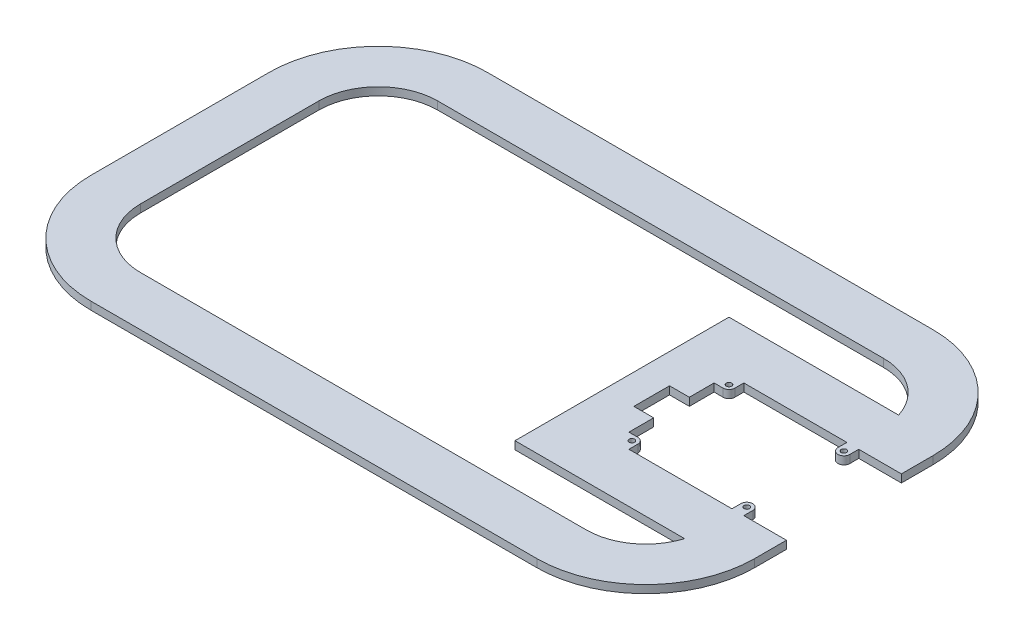
from build123d import *

# Parameters (mm, degrees)
SKETCH1_R           = 1.375
BOSS_EXTRUDE1_DEPTH = 4


with BuildPart() as part:
    # Sketch1 → Boss-Extrude1 (new body)
    with BuildSketch(Plane(origin=(0, 0, 0), x_dir=(1, 0, 0), z_dir=(0, 1, 0))):
        with BuildLine():
            Line((55, 0), (280, 0))
            ThreePointArc((280, 0), (318.890872965, 16.109127035), (335, 55))
            Line((335, 55), (335, 71))
            Line((335, 71), (313.5, 71))
            Line((313.5, 71), (313.5, 75.5))
            ThreePointArc((313.5, 75.5), (310.5, 78.5), (307.5, 75.5))
            Line((307.5, 75.5), (307.5, 71))
            Line((307.5, 71), (255.5, 71))
            Line((255.5, 71), (255.5, 75.5))
            ThreePointArc((255.5, 75.5), (254.621320344, 77.621320344), (252.5, 78.5))
            Line((252.5, 78.5), (248, 78.5))
            Line((248, 78.5), (248, 91))
            Line((248, 91), (238, 91))
            Line((238, 91), (238, 109))
            Line((238, 109), (248, 109))
            Line((248, 109), (248, 121.5))
            Line((248, 121.5), (252.5, 121.5))
            ThreePointArc((252.5, 121.5), (254.621320344, 122.378679656), (255.5, 124.5))
            Line((255.5, 124.5), (255.5, 129))
            Line((255.5, 129), (307.5, 129))
            Line((307.5, 129), (307.5, 124.5))
            ThreePointArc((307.5, 124.5), (310.5, 121.5), (313.5, 124.5))
            Line((313.5, 124.5), (313.5, 129))
            Line((313.5, 129), (335, 129))
            Line((335, 129), (335, 145))
            ThreePointArc((335, 145), (318.890872965, 183.890872965), (280, 200))
            Line((280, 200), (55, 200))
            ThreePointArc((55, 200), (16.109127035, 183.890872965), (0, 145))
            Line((0, 145), (0, 55))
            ThreePointArc((0, 55), (16.109127035, 16.109127035), (55, 0))
        make_face()
        with Locations(Location((252.5, 124.5, 0), (0, 0, 270))):
            Circle(SKETCH1_R, mode=Mode.SUBTRACT)
        with Locations(Location((252.5, 75.5, 0), (0, 0, 90))):
            Circle(SKETCH1_R, mode=Mode.SUBTRACT)
        with Locations(Location((310.5, 124.5, 0), (0, 0, 270))):
            Circle(SKETCH1_R, mode=Mode.SUBTRACT)
        with Locations(Location((310.5, 75.5, 0), (0, 0, 90))):
            Circle(SKETCH1_R, mode=Mode.SUBTRACT)
        with BuildLine():
            Line((55, 25), (280, 25))
            ThreePointArc((280, 25), (297.748239349, 30.813226755), (308.618176043, 46))
            Line((308.618176043, 46), (223, 46))
            Line((223, 46), (223, 154))
            Line((223, 154), (308.618176043, 154))
            ThreePointArc((308.618176043, 154), (297.748239349, 169.186773245), (280, 175))
            Line((280, 175), (55, 175))
            ThreePointArc((55, 175), (33.786796564, 166.213203436), (25, 145))
            Line((25, 145), (25, 55))
            ThreePointArc((25, 55), (33.786796564, 33.786796564), (55, 25))
        make_face(mode=Mode.SUBTRACT)
    extrude(amount=BOSS_EXTRUDE1_DEPTH)


solid = part.part
